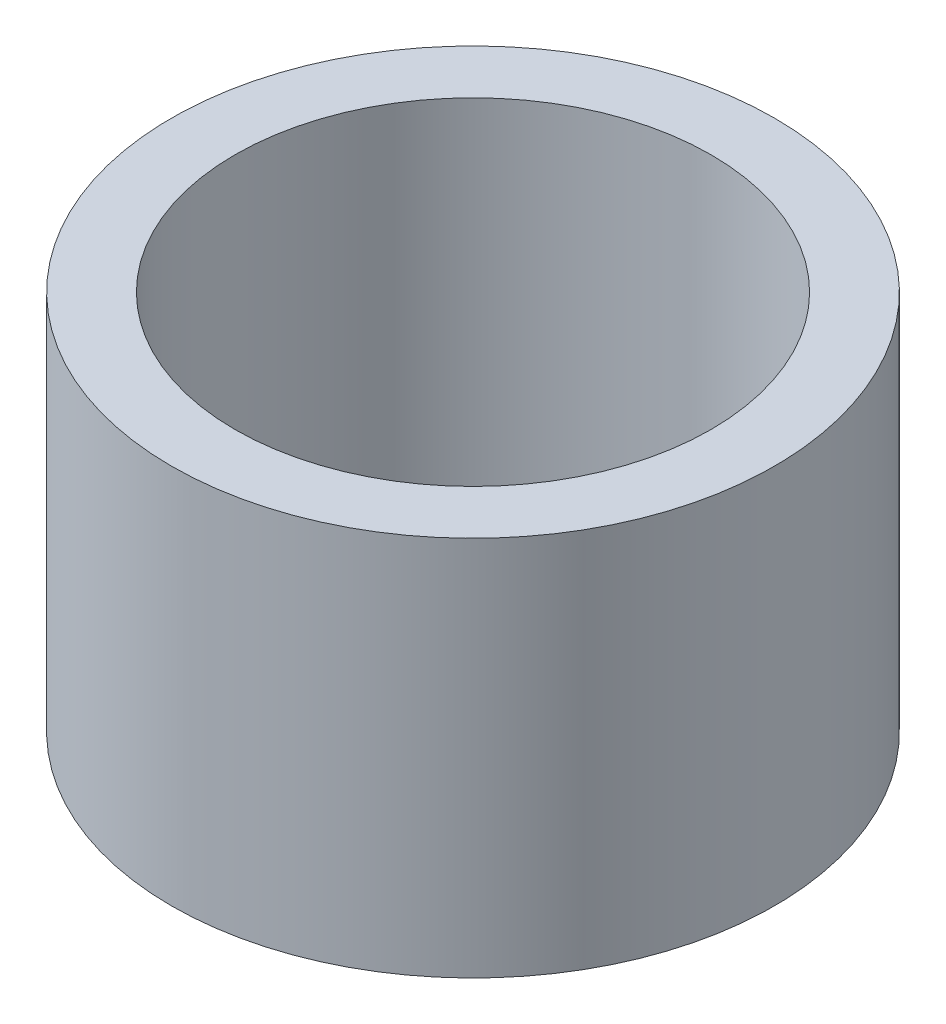
from build123d import *

# Parameters (mm, degrees)
SKETCH_1_R      = 9.5
SKETCH_1_R_2    = 7.5
EXTRUDE_1_DEPTH = 12


with BuildPart() as part:
    # 草图1 → 凸台-拉伸1 (new body)
    with BuildSketch(Plane(origin=(0, 0, 0), x_dir=(1, 0, 0), z_dir=(0, 1, 0))):
        with Locations(Location((0, 0, 0), (0, 0, 270))):
            Circle(SKETCH_1_R)
        with Locations(Location((0, 0, 0), (0, 0, 270))):
            Circle(SKETCH_1_R_2, mode=Mode.SUBTRACT)
    extrude(amount=EXTRUDE_1_DEPTH)


solid = part.part
